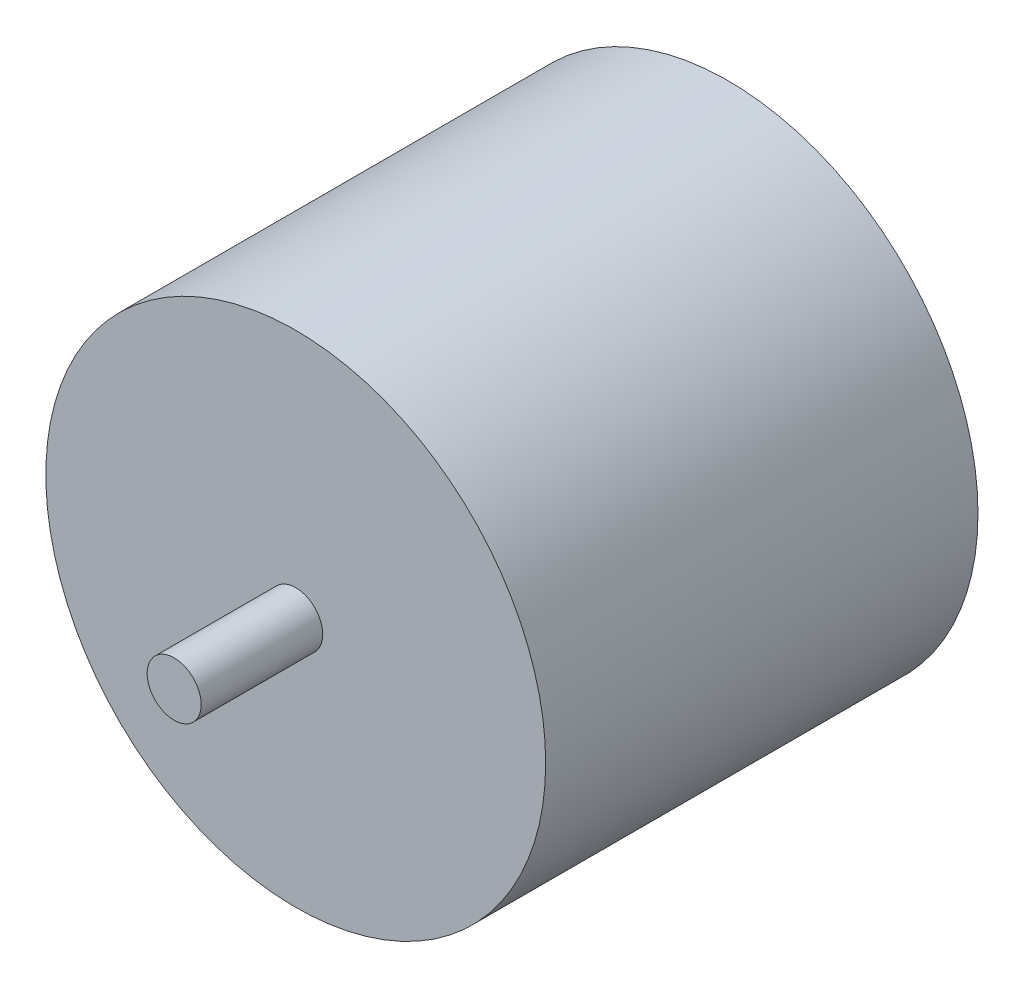
from build123d import *

# Parameters (mm, degrees)
SKETCH2_R           = 18.5
BOSS_EXTRUDE1_DEPTH = 32
SKETCH3_R           = 2
BOSS_EXTRUDE3_DEPTH = 9


with BuildPart() as part:
    # Sketch2 → Boss-Extrude1 (new body)
    with BuildSketch(Plane.XY):
        Circle(SKETCH2_R)
    extrude(amount=-BOSS_EXTRUDE1_DEPTH)

    # Sketch3 → Boss-Extrude3 (add)
    with BuildSketch(Plane.XY):
        Circle(SKETCH3_R)
    extrude(amount=BOSS_EXTRUDE3_DEPTH)


solid = part.part
